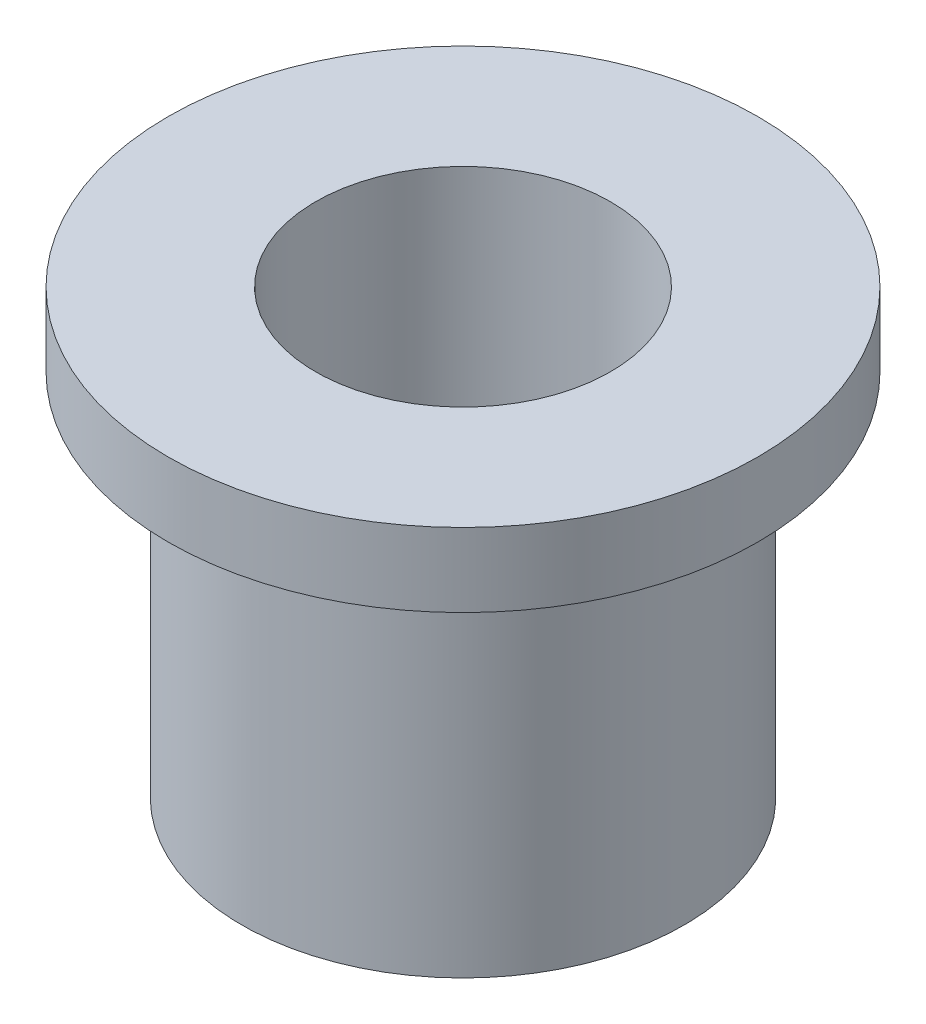
from build123d import *


with BuildPart() as part:
    # Sketch1 → Revolve1 (revolve)
    with BuildSketch(Plane(origin=(0, 0, 0), x_dir=(0, 0, -1), z_dir=(1, 0, 0))):
        Polygon((3.175, 0), (3.175, 9.525), (6.35, 9.525), (6.35, 7.9375), (4.7625, 7.9375), (4.7625, 0), align=None)
    revolve(axis=Axis((0, 0, 0), (0, 1, 0)))


solid = part.part
